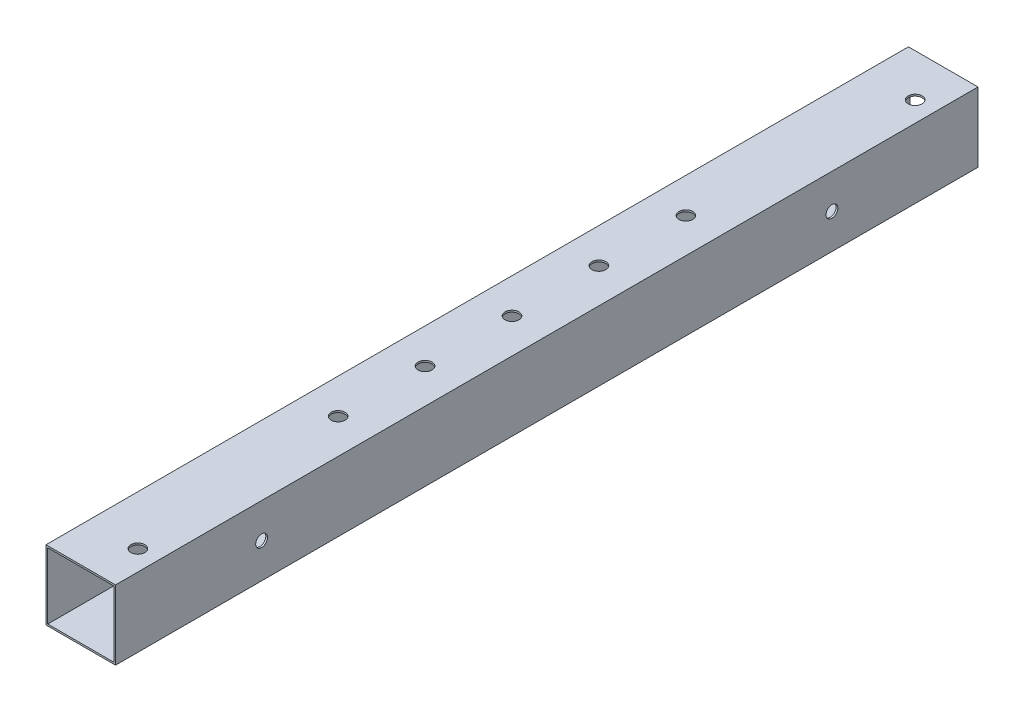
from build123d import *

# Parameters (mm, degrees)
SKETCH_1_W          = 20
SKETCH_1_H          = 20
SKETCH_1_W_2        = 19
SKETCH_1_H_2        = 19
EXTRUDE_1_DEPTH     = 248
SKETCH_2_R          = 2
CUT_EXTRUDE_1_DEPTH = 250.006024024
SKETCH_3_R          = 2
CUT_EXTRUDE_2_DEPTH = 250.006024024
SKETCH_4_R          = 1.7
CUT_EXTRUDE_3_DEPTH = 250.006024024


with BuildPart() as part:
    # 草图1 → 凸台-拉伸1 (new body)
    with BuildSketch(Plane.XY):
        Rectangle(SKETCH_1_W, SKETCH_1_H)
        Rectangle(SKETCH_1_W_2, SKETCH_1_H_2, mode=Mode.SUBTRACT)
    extrude(amount=-EXTRUDE_1_DEPTH)

    # 草图2 → 切除-拉伸1 (cut, through all)
    with BuildSketch(Plane(origin=(0, 10, 0), x_dir=(1, 0, 0), z_dir=(0, 1, 0))):
        with Locations(Location((4.171407716, 12.25, 0), (0, 0, 270))):
            Circle(SKETCH_2_R)
        with Locations((4.171407716, 235.75)):
            Circle(SKETCH_2_R)
    extrude(amount=-CUT_EXTRUDE_1_DEPTH, mode=Mode.SUBTRACT)

    # 草图3 → 切除-拉伸2 (cut, through all)
    with BuildSketch(Plane(origin=(0, 10, 0), x_dir=(1, 0, 0), z_dir=(0, 1, 0))):
        with Locations(Location((0, 74, 0), (0, 0, 270))):
            Circle(SKETCH_3_R)
        with Locations(Location((0, 99, 0), (0, 0, 270))):
            Circle(SKETCH_3_R)
        with Locations(Location((0, 124, 0), (0, 0, 270))):
            Circle(SKETCH_3_R)
        with Locations(Location((0, 149, 0), (0, 0, 270))):
            Circle(SKETCH_3_R)
        with Locations(Location((0, 174, 0), (0, 0, 270))):
            Circle(SKETCH_3_R)
    extrude(amount=-CUT_EXTRUDE_2_DEPTH, mode=Mode.SUBTRACT)

    # 草图4 → 切除-拉伸3 (cut, through all)
    with BuildSketch(Plane(origin=(10, 0, 0), x_dir=(0, 0, -1), z_dir=(1, 0, 0))):
        with Locations((42, 0)):
            Circle(SKETCH_4_R)
        with Locations((206, 0)):
            Circle(SKETCH_4_R)
    extrude(amount=-CUT_EXTRUDE_3_DEPTH, mode=Mode.SUBTRACT)


solid = part.part
